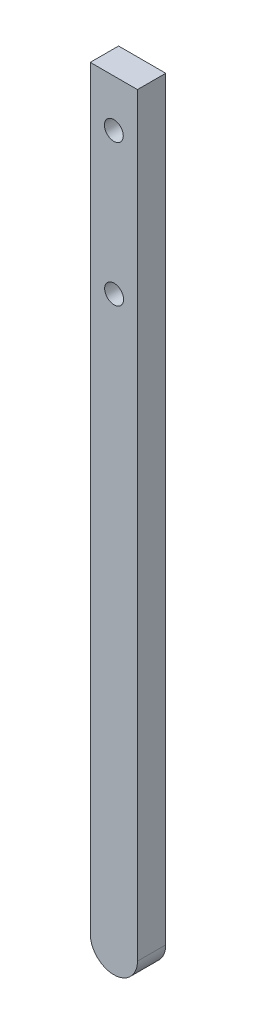
from build123d import *

# Parameters (mm, degrees)
BOSS_EXTRUDE1_DEPTH = 3
SKETCH2_R           = 1
CUT_EXTRUDE1_DEPTH  = 43.679034666


with BuildPart() as part:
    # Sketch1 → Boss-Extrude1 (new body)
    with BuildSketch(Plane.XY):
        with BuildLine():
            Line((2.5, 40), (-2.5, 40))
            Line((-2.5, 40), (-2.5, -40))
            ThreePointArc((-2.5, -40), (0, -42.5), (2.5, -40))
            Line((2.5, -40), (2.5, 40))
        make_face()
    extrude(amount=BOSS_EXTRUDE1_DEPTH)

    # Sketch2 → Cut-Extrude1 (cut, through all)
    with BuildSketch(Plane.XY.offset(3)):
        with Locations((0, 35)):
            Circle(SKETCH2_R)
        with Locations((0.025500912, 20)):
            Circle(SKETCH2_R)
    extrude(amount=-CUT_EXTRUDE1_DEPTH, mode=Mode.SUBTRACT)


solid = part.part
